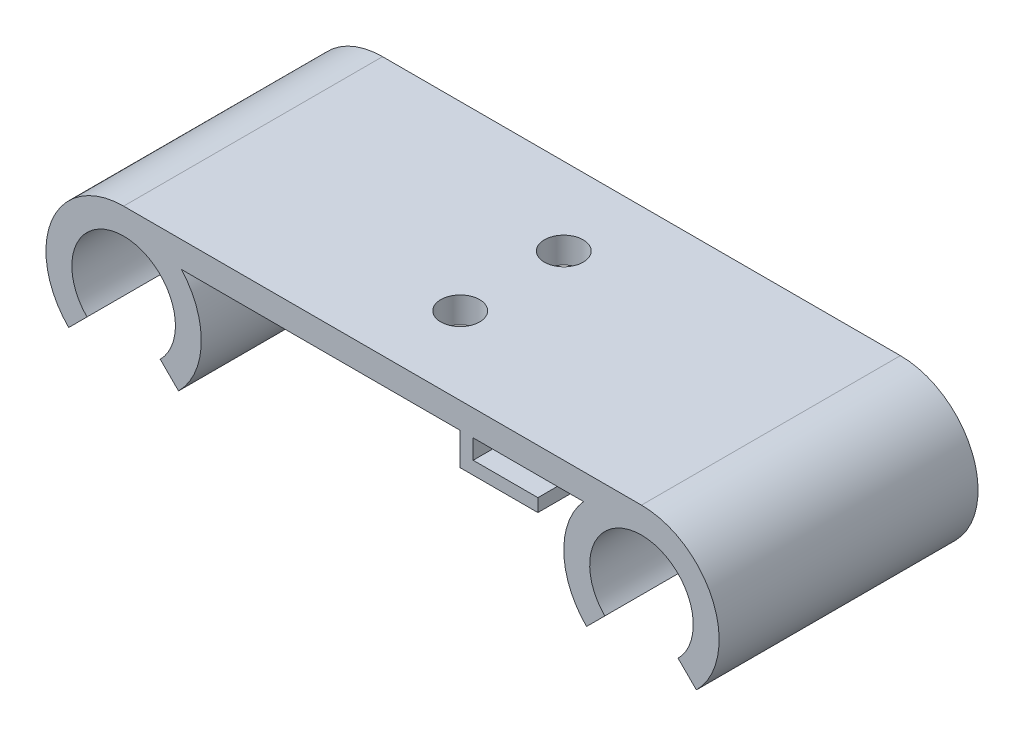
from build123d import *

# Parameters (mm, degrees)
BOSS_EXTRU_1_DEPTH      = 20
ESQUISSE2_R             = 1.5
ENL_V_MAT_EXTRU_1_DEPTH = 20


with BuildPart() as part:
    # Esquisse1 → Boss.-Extru.1 (new body)
    with BuildSketch(Plane.XY):
        with BuildLine():
            Line((46, 12), (6, 12))
            ThreePointArc((6, 12), (0.456722805, 8.296100594), (1.757359313, 1.757359313))
            Line((1.757359313, 1.757359313), (3.171572875, 3.171572875))
            ThreePointArc((3.171572875, 3.171572875), (6, 10), (8.828427125, 3.171572875))
            Line((8.828427125, 3.171572875), (10.242640687, 1.757359313))
            ThreePointArc((10.242640687, 1.757359313), (11.997675746, 5.833010044), (10.472135955, 10))
            Line((10.472135955, 10), (32, 10))
            Line((32, 10), (32, 7.5))
            Line((32, 7.5), (38, 7.5))
            Line((38, 7.5), (38, 8.5))
            Line((38, 8.5), (33, 8.5))
            Line((33, 8.5), (33, 10))
            Line((33, 10), (41.527864045, 10))
            ThreePointArc((41.527864045, 10), (40.002324254, 5.833010044), (41.757359313, 1.757359313))
            Line((41.757359313, 1.757359313), (43.171572875, 3.171572875))
            ThreePointArc((43.171572875, 3.171572875), (46, 10), (48.828427125, 3.171572875))
            Line((48.828427125, 3.171572875), (50.242640687, 1.757359313))
            ThreePointArc((50.242640687, 1.757359313), (51.543277195, 8.296100594), (46, 12))
        make_face()
    extrude(amount=BOSS_EXTRU_1_DEPTH)

    # Esquisse2 → Enlèv. mat.-Extru.1 (cut)
    with BuildSketch(Plane(origin=(0, 12, 0), x_dir=(1, 0, 0), z_dir=(0, 1, 0))):
        with Locations(Location((26, -6, 0), (0, 0, 270))):
            Circle(ESQUISSE2_R)
        with Locations(Location((26, -14, 0), (0, 0, 270))):
            Circle(ESQUISSE2_R)
    extrude(amount=-ENL_V_MAT_EXTRU_1_DEPTH, mode=Mode.SUBTRACT)


solid = part.part
